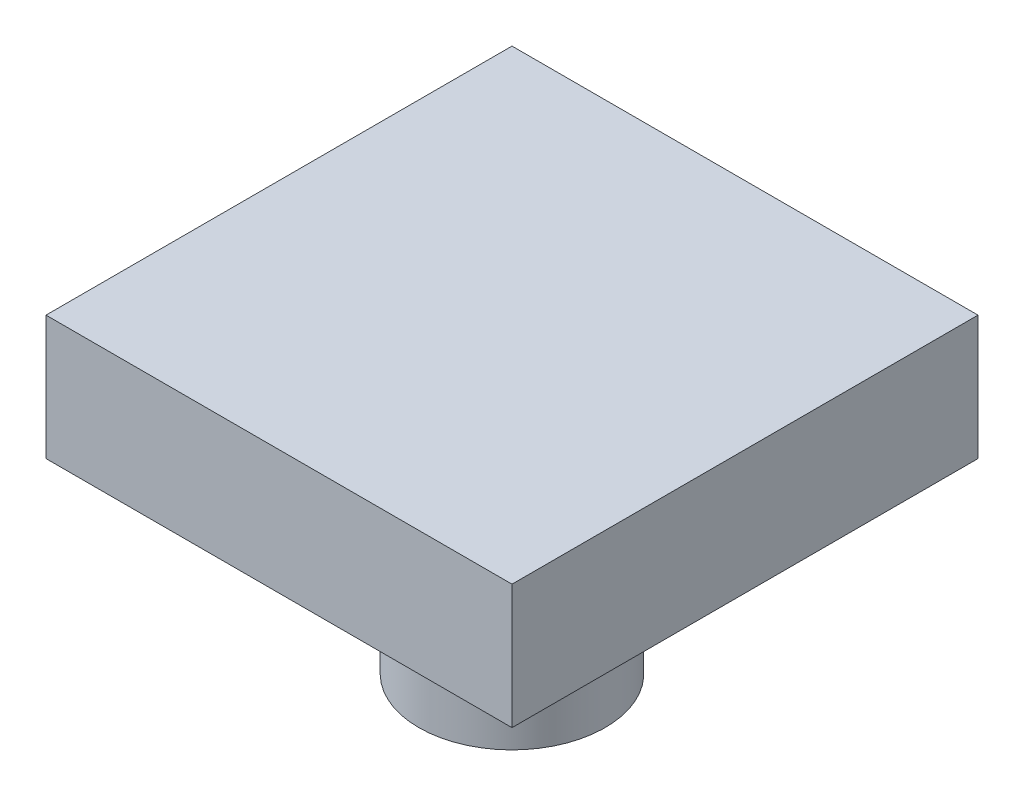
from build123d import *

# Parameters (mm, degrees)
SKETCH1_W           = 30
SKETCH1_H           = 30
BOSS_EXTRUDE1_DEPTH = 8
SKETCH2_R           = 6
BOSS_EXTRUDE2_DEPTH = 12


with BuildPart() as part:
    # Sketch1 → Boss-Extrude1 (new body)
    with BuildSketch(Plane(origin=(0, 0, 0), x_dir=(1, 0, 0), z_dir=(0, 1, 0))):
        Rectangle(SKETCH1_W, SKETCH1_H)
    extrude(amount=BOSS_EXTRUDE1_DEPTH)

    # Sketch2 → Boss-Extrude2 (add)
    with BuildSketch(Plane(origin=(0, 0, 0), x_dir=(1, 0, 0), z_dir=(0, 1, 0))):
        with Locations(Location((0, 0, 0), (0, 0, 270))):
            Circle(SKETCH2_R)
    extrude(amount=-BOSS_EXTRUDE2_DEPTH)


solid = part.part
